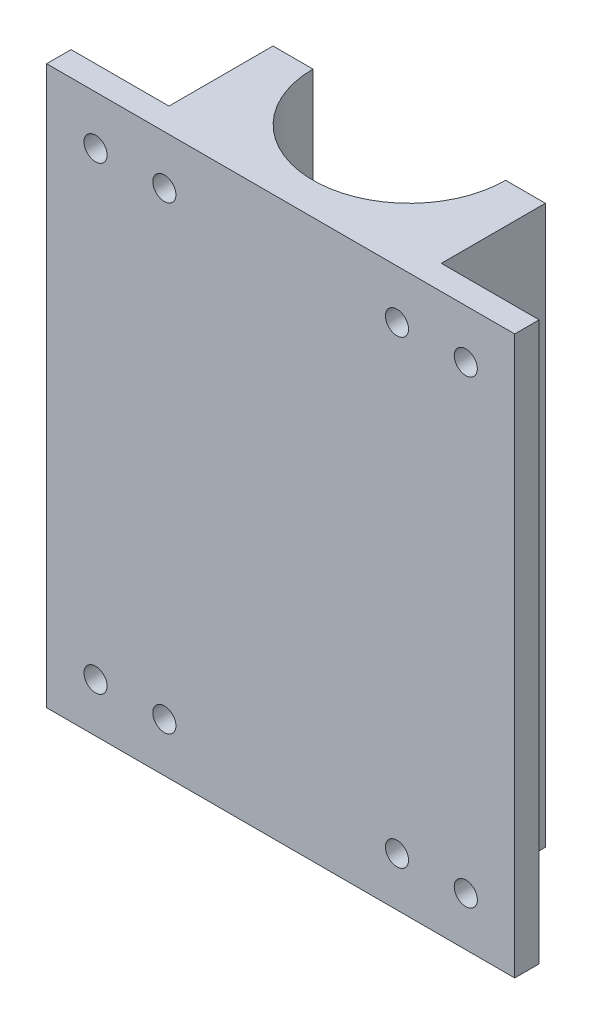
from build123d import *

# Parameters (mm, degrees)
BOSS_EXTRUDE2_DEPTH       = 72.39
BOSS_EXTRUDE3_DEPTH       = 51.39
F_3_0MM_DOWEL_HOLE1_D     = 3
F_3_0MM_DOWEL_HOLE1_DEPTH = 10
F_3_0MM_DOWEL_HOLE1_TIP   = 0.901290929
F_3_0MM_DOWEL_HOLE2_D     = 3
F_3_0MM_DOWEL_HOLE2_DEPTH = 20
F_3_0MM_DOWEL_HOLE2_TIP   = 0.901290929


with BuildPart() as part:
    # Sketch1 → Boss-Extrude2 (new body)
    with BuildSketch(Plane(origin=(0, 0, 0), x_dir=(1, 0, 0), z_dir=(0, 1, 0))):
        with BuildLine():
            Line((-11.1466884, 17.698170271), (-23.8485284, 17.698170271))
            Line((-23.8485284, 17.698170271), (-23.8485284, 14.523170271))
            Line((-23.8485284, 14.523170271), (36.9033116, 14.523170271))
            Line((36.9033116, 14.523170271), (36.9033116, 17.698170271))
            Line((36.9033116, 17.698170271), (24.2033116, 17.698170271))
            Line((24.2033116, 17.698170271), (24.2033116, 31.204775661))
            Line((24.2033116, 31.204775661), (19.041964554, 31.204775661))
            ThreePointArc((19.041964554, 31.204775661), (6.541964554, 18.704775661), (-5.958035446, 31.204775661))
            Line((-5.958035446, 31.204775661), (-11.1466884, 31.204775661))
            Line((-11.1466884, 31.204775661), (-11.1466884, 17.698170271))
        make_face()
    extrude(amount=BOSS_EXTRUDE2_DEPTH)

    # Sketch1<16> → Boss-Extrude3 (add)
    with BuildSketch(Plane(origin=(0, 0, 0), x_dir=(1, 0, 0), z_dir=(0, 1, 0))):
        with BuildLine():
            Line((-5.958035446, 31.204775661), (-5.658035446, 31.204775661))
            ThreePointArc((-5.658035446, 31.204775661), (6.541964554, 19.004775661), (18.741964554, 31.204775661))
            Line((18.741964554, 31.204775661), (19.041964554, 31.204775661))
            ThreePointArc((19.041964554, 31.204775661), (6.541964554, 18.704775661), (-5.958035446, 31.204775661))
        make_face()
    extrude(amount=BOSS_EXTRUDE3_DEPTH)

    # Ø3.0mm Dowel Hole1
    with Locations(Plane(origin=(0, 0, -17.698170271), x_dir=(-1, 0, 0), z_dir=(0, 0, -1))):
        with Locations((-30.5533116, 66.04), (-30.5533116, 6.35), (17.4985284, 6.35), (17.4985284, 66.04)):
            Hole(F_3_0MM_DOWEL_HOLE1_D / 2, depth=F_3_0MM_DOWEL_HOLE1_DEPTH)
            with Locations((0, 0, -(F_3_0MM_DOWEL_HOLE1_DEPTH + F_3_0MM_DOWEL_HOLE1_TIP / 2))):  # 118° drill point
                Cone(0, F_3_0MM_DOWEL_HOLE1_D / 2, F_3_0MM_DOWEL_HOLE1_TIP, mode=Mode.SUBTRACT)

    # Ø3.0mm Dowel Hole2
    with Locations(Plane(origin=(0, 0, -31.204775661), x_dir=(-1, 0, 0), z_dir=(0, 0, -1))):
        with Locations((-21.6233116, 66.04), (-21.6233116, 6.35), (8.5666884, 6.35), (8.5666884, 66.04)):
            Hole(F_3_0MM_DOWEL_HOLE2_D / 2, depth=F_3_0MM_DOWEL_HOLE2_DEPTH)
            with Locations((0, 0, -(F_3_0MM_DOWEL_HOLE2_DEPTH + F_3_0MM_DOWEL_HOLE2_TIP / 2))):  # 118° drill point
                Cone(0, F_3_0MM_DOWEL_HOLE2_D / 2, F_3_0MM_DOWEL_HOLE2_TIP, mode=Mode.SUBTRACT)


solid = part.part
